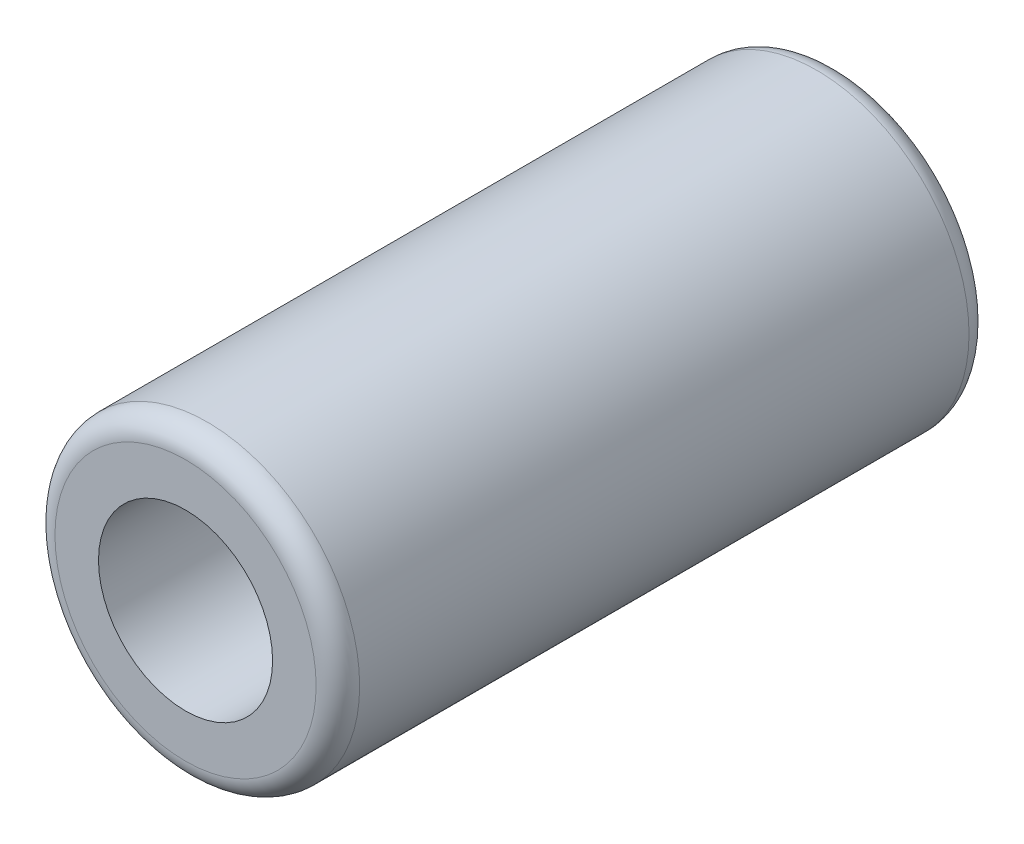
from build123d import *

# Parameters (mm, degrees)
SKETCH1_R           = 7
SKETCH1_R_2         = 2.5
BOSS_EXTRUDE1_DEPTH = 30
SKETCH2_R           = 4
CUT_EXTRUDE1_DEPTH  = 15
FILLET1_R           = 1


with BuildPart() as part:
    # Sketch1 → Boss-Extrude1 (new body)
    with BuildSketch(Plane.XY):
        Circle(SKETCH1_R)
        Circle(SKETCH1_R_2, mode=Mode.SUBTRACT)
    extrude(amount=BOSS_EXTRUDE1_DEPTH)

    # Sketch2 → Cut-Extrude1 (cut)
    with BuildSketch(Plane.XY.offset(30)):
        Circle(SKETCH2_R)
    extrude(amount=-CUT_EXTRUDE1_DEPTH, mode=Mode.SUBTRACT)

    # Fillet1
    fillet1_edges = [part.edges().sort_by_distance(p)[0] for p in [
        (-7, 0, 0),
        (-7, 0, 30),
    ]]
    fillet(fillet1_edges, radius=FILLET1_R)


solid = part.part
